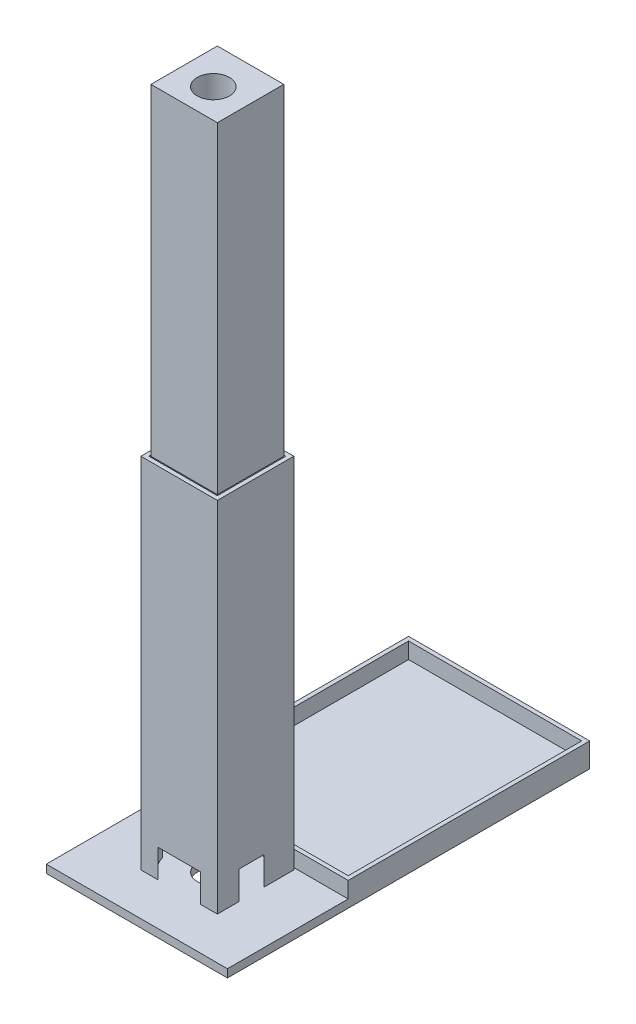
from build123d import *

# Parameters (mm, degrees)
SKETCH1_W             = 20
SKETCH1_H             = 20
SKETCH1_R             = 4
SKETCH1_H_2           = 10
BOSS_EXTRUDE2_DEPTH   = 2
SKETCH2_W             = 45
SKETCH2_H             = 60
SKETCH2_W_2           = 43
SKETCH2_H_2           = 58
BOSS_EXTRUDE3_DEPTH   = 4
SKETCH6_W             = 45
SKETCH6_H             = 30
BOSS_EXTRUDE4_DEPTH   = 2
CUT_EXTRUDE4_DEPTH    = 4
BOSS_EXTRUDE5_DEPTH   = 7
BOSS_EXTRUDE5_2_DEPTH = 7
BOSS_EXTRUDE5_3_DEPTH = 7
SKETCH11_W            = 19
SKETCH11_H            = 19
BOSS_EXTRUDE6_DEPTH   = 2
SKETCH14_R            = 4
CUT_EXTRUDE7_DEPTH    = 19
SKETCH15_W            = 1
SKETCH15_H            = 17
SKETCH15_H_2          = 1
BOSS_EXTRUDE7_DEPTH   = 80
SKETCH16_W            = 16.5
SKETCH16_H            = 16.5
BOSS_EXTRUDE8_DEPTH   = 80
SKETCH17_R            = 4
CUT_EXTRUDE8_DEPTH    = 193


with BuildPart() as part:
    # Sketch1 → Boss-Extrude2 (new body)
    # profile 1 of 6: a face of its own
    with BuildSketch(Plane(origin=(0, 0, 0), x_dir=(1, 0, 0), z_dir=(0, 1, 0))):
        Polygon((-22.5, 10), (-10, 10), (10, 10), (22.5, 10), (22.5, 70), (-22.5, 70), align=None)
    # profile 2 of 6: a face of its own
    with BuildSketch(Plane(origin=(0, 0, 0), x_dir=(1, 0, 0), z_dir=(0, 1, 0))):
        Polygon((-22.5, 10), (-10, -10), (-10, 10), align=None)
    # profile 3 of 6: a face of its own
    with BuildSketch(Plane(origin=(0, 0, 0), x_dir=(1, 0, 0), z_dir=(0, 1, 0))):
        Polygon((10, 10), (10, -10), (22.5, 10), align=None)
    # profile 4 of 6: a face of its own
    with BuildSketch(Plane(origin=(0, 0, 0), x_dir=(1, 0, 0), z_dir=(0, 1, 0))):
        Rectangle(SKETCH1_W, SKETCH1_H)
        Circle(SKETCH1_R, mode=Mode.SUBTRACT)
    # profile 5 of 6: a face of its own
    with BuildSketch(Plane(origin=(0, 0, 0), x_dir=(1, 0, 0), z_dir=(0, 1, 0))):
        Circle(SKETCH1_R)
    # profile 6 of 6: a face of its own
    with BuildSketch(Plane(origin=(0, 0, 0), x_dir=(1, 0, 0), z_dir=(0, 1, 0))):
        with Locations((0, -15)):
            Rectangle(SKETCH1_W, SKETCH1_H_2)
    extrude(amount=BOSS_EXTRUDE2_DEPTH)

    # Sketch2 → Boss-Extrude3 (add)
    with BuildSketch(Plane(origin=(0, 2, 0), x_dir=(1, 0, 0), z_dir=(0, 1, 0))):
        with Locations((0, 40)):
            Rectangle(SKETCH2_W, SKETCH2_H)
        with Locations((0, 40)):
            Rectangle(SKETCH2_W_2, SKETCH2_H_2, mode=Mode.SUBTRACT)
    extrude(amount=BOSS_EXTRUDE3_DEPTH)

    # Sketch6 → Boss-Extrude4 (add)
    with BuildSketch(Plane(origin=(0, 2, 0), x_dir=(1, 0, 0), z_dir=(0, 1, 0))):
        with Locations((0, -5)):
            Rectangle(SKETCH6_W, SKETCH6_H)
    extrude(amount=-BOSS_EXTRUDE4_DEPTH)

    # Sketch7 → Cut-Extrude4 (cut)
    with BuildSketch(Plane(origin=(0, 2, 0), x_dir=(1, 0, 0), z_dir=(0, 1, 0))):
        with BuildLine():
            Line((9.5, 9.5), (-9.5, 9.5))
            Line((-9.5, 9.5), (-9.5, 2.122498999))
            ThreePointArc((-9.5, 2.122498999), (0, 9), (9.5, 2.122498999))
            Line((9.5, 2.122498999), (9.5, 9.5))
        make_face()
        with BuildLine():
            ThreePointArc((-5.267826876, -9.5), (-7.858215886, -7.184532568), (-9.5, -4.122498999))
            Line((-9.5, -4.122498999), (-9.5, -9.5))
            Line((-9.5, -9.5), (-5.267826876, -9.5))
        make_face()
        with BuildLine():
            Line((9.5, -9.5), (9.5, -4.122498999))
            ThreePointArc((9.5, -4.122498999), (7.858215886, -7.184532568), (5.267826876, -9.5))
            Line((5.267826876, -9.5), (9.5, -9.5))
        make_face()
    extrude(amount=-CUT_EXTRUDE4_DEPTH, mode=Mode.SUBTRACT)


with BuildPart() as body_2:
    # Sketch8 → Boss-Extrude5 (new body)
    with BuildSketch(Plane(origin=(0, 2, 0), x_dir=(1, 0, 0), z_dir=(0, 1, 0))):
        with BuildLine():
            Line((9.5, 2.122498999), (9.5, 9.5))
            Line((9.5, 9.5), (-9.5, 9.5))
            Line((-9.5, 9.5), (-9.5, 2.122498999))
            ThreePointArc((-9.5, 2.122498999), (0, 9), (9.5, 2.122498999))
        make_face()
    extrude(amount=BOSS_EXTRUDE5_DEPTH)



with BuildPart() as body_3:
    # Sketch8 → Boss-Extrude5 2 (new body)
    with BuildSketch(Plane(origin=(0, 2, 0), x_dir=(1, 0, 0), z_dir=(0, 1, 0))):
        with BuildLine():
            Line((-9.5, -9.5), (-5.267826876, -9.5))
            ThreePointArc((-5.267826876, -9.5), (-7.858215886, -7.184532568), (-9.5, -4.122498999))
            Line((-9.5, -4.122498999), (-9.5, -9.5))
        make_face()
    extrude(amount=BOSS_EXTRUDE5_2_DEPTH)


with BuildPart() as body_4:
    # Sketch8 → Boss-Extrude5 3 (new body)
    with BuildSketch(Plane(origin=(0, 2, 0), x_dir=(1, 0, 0), z_dir=(0, 1, 0))):
        with BuildLine():
            Line((9.5, -9.5), (9.5, -4.122498999))
            ThreePointArc((9.5, -4.122498999), (7.858215886, -7.184532568), (5.267826876, -9.5))
            Line((5.267826876, -9.5), (9.5, -9.5))
        make_face()
    extrude(amount=BOSS_EXTRUDE5_3_DEPTH)


with BuildPart() as body_2_1:
    add(body_2.part)

    add(body_3.part)  # Boss-Extrude6 merges body 3

    add(body_4.part)  # Boss-Extrude6 merges body 4
    # Sketch11 → Boss-Extrude6 (add)
    with BuildSketch(Plane(origin=(0, 9, 0), x_dir=(1, 0, 0), z_dir=(0, 1, 0))):
        Rectangle(SKETCH11_W, SKETCH11_H)
    extrude(amount=BOSS_EXTRUDE6_DEPTH)


with BuildPart() as cut_extrude7_tool:
    # Sketch14 → Cut-Extrude7 (new body)
    with BuildSketch(Plane.XZ):
        with Locations(Location((0, 1, 0), (0, 0, 90))):
            Circle(SKETCH14_R)
    extrude(amount=-CUT_EXTRUDE7_DEPTH)


with BuildPart() as part_1:
    add(part.part)

    # Cut-Extrude7: cut by cut_extrude7_tool
    add(cut_extrude7_tool.part, mode=Mode.SUBTRACT)


with BuildPart() as body_2_2:
    add(body_2_1.part)

    # Cut-Extrude7: cut by cut_extrude7_tool
    add(cut_extrude7_tool.part, mode=Mode.SUBTRACT)

    # Sketch15 → Boss-Extrude7 (add)
    with BuildSketch(Plane(origin=(0, 11, 0), x_dir=(1, 0, 0), z_dir=(0, 1, 0))):
        Polygon((-8.5, 8.5), (8.5, 8.5), (8.5, 9.5), (-9.5, 9.5), (-9.5, -9.5), (8.5, -9.5), (8.5, -8.5), (-8.5, -8.5), align=None)
        with Locations((9, 0)):
            Rectangle(SKETCH15_W, SKETCH15_H)
        with Locations((9, 9)):
            Rectangle(SKETCH15_W, SKETCH15_H_2)
        with Locations((9, -9)):
            Rectangle(SKETCH15_W, SKETCH15_H_2)
    extrude(amount=BOSS_EXTRUDE7_DEPTH)


with BuildPart() as body_3_2:
    # Sketch16 → Boss-Extrude8 (new body)
    with BuildSketch(Plane(origin=(0, 91, 0), x_dir=(1, 0, 0), z_dir=(0, 1, 0))):
        Rectangle(SKETCH16_W, SKETCH16_H)
    extrude(amount=BOSS_EXTRUDE8_DEPTH)

    # Sketch17 → Cut-Extrude8 (cut)
    with BuildSketch(Plane.XZ):
        with Locations(Location((0, 1, 0), (0, 0, 270))):
            Circle(SKETCH17_R)
    extrude(amount=-CUT_EXTRUDE8_DEPTH, mode=Mode.SUBTRACT)


solid = Compound([part_1.part, body_2_2.part, body_3_2.part])
